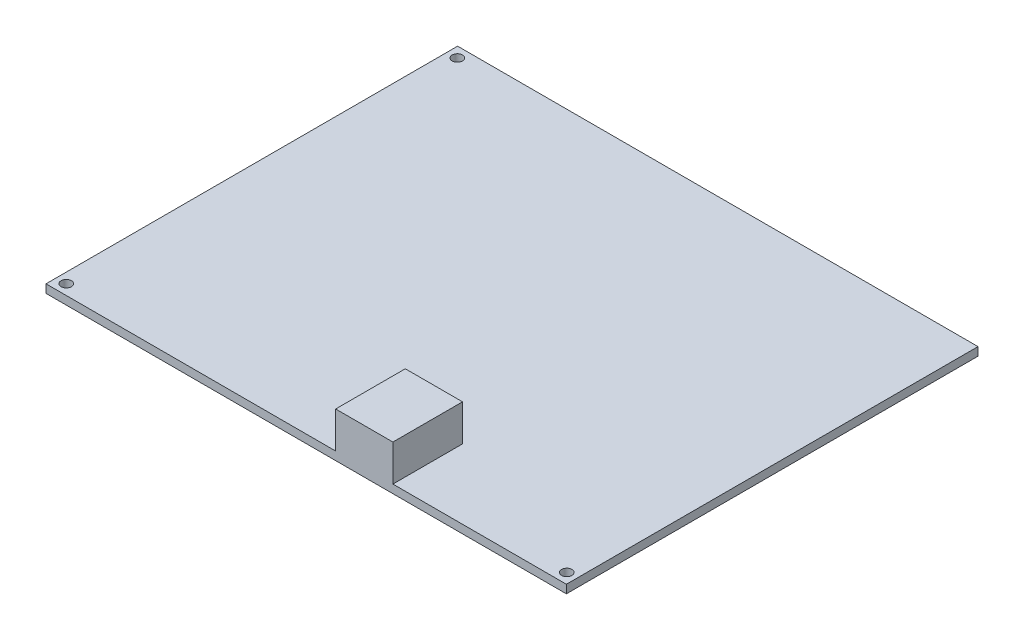
from build123d import *

# Parameters (mm, degrees)
SKETCH_1_W      = 100
SKETCH_1_H      = 79.1
SKETCH_1_R      = 1
EXTRUDE_1_DEPTH = 1.6
SKETCH_2_W      = 11
SKETCH_2_H      = 13.382
EXTRUDE_2_DEPTH = 7


with BuildPart() as part:
    # 草图1 → 凸台-拉伸1 (new body)
    with BuildSketch(Plane(origin=(0, 0, 0), x_dir=(1, 0, 0), z_dir=(0, 1, 0))):
        with Locations((50, 39.55)):
            Rectangle(SKETCH_1_W, SKETCH_1_H)
        with Locations(Location((1.942, 77.109, 0), (0, 0, 270))):
            Circle(SKETCH_1_R, mode=Mode.SUBTRACT)
        with Locations(Location((1.93, 1.968, 0), (0, 0, 270))):
            Circle(SKETCH_1_R, mode=Mode.SUBTRACT)
        with Locations(Location((98.066, 2.005, 0), (0, 0, 270))):
            Circle(SKETCH_1_R, mode=Mode.SUBTRACT)
    extrude(amount=EXTRUDE_1_DEPTH)

    # 草图2 → 凸台-拉伸2 (add)
    with BuildSketch(Plane(origin=(0, 1.6, 0), x_dir=(1, 0, 0), z_dir=(0, 1, 0))):
        with Locations((61.163, 6.691)):
            Rectangle(SKETCH_2_W, SKETCH_2_H)
    extrude(amount=EXTRUDE_2_DEPTH)


solid = part.part
